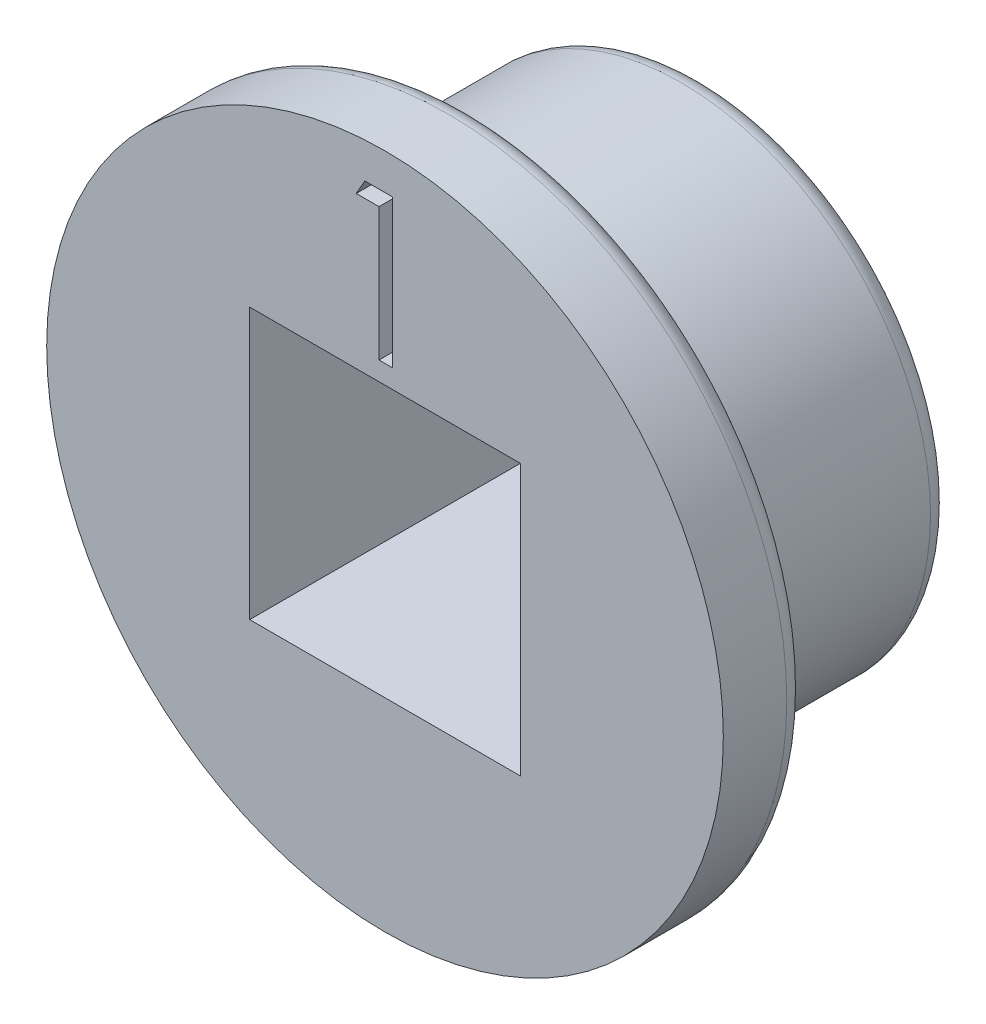
from build123d import *

# Parameters (mm, degrees)
SKETCH1_R           = 5.9
SKETCH1_W           = 6.4
SKETCH1_H           = 6.4
BOSS_EXTRUDE1_DEPTH = 5.5
SKETCH1_3_R         = 8
SKETCH1_3_W         = 6.4
SKETCH1_3_H         = 6.4
BOSS_EXTRUDE2_DEPTH = 2
FILLET1_R           = 0.5
CUT_EXTRUDE1_DEPTH  = 0.5


with BuildPart() as part:
    # Sketch1 → Boss-Extrude1 (new body)
    with BuildSketch(Plane.XY):
        Circle(SKETCH1_R)
        Rectangle(SKETCH1_W, SKETCH1_H, mode=Mode.SUBTRACT)
    extrude(amount=-BOSS_EXTRUDE1_DEPTH)

    # Sketch1<3> → Boss-Extrude2 (add)
    with BuildSketch(Plane.XY):
        Circle(SKETCH1_3_R)
        Rectangle(SKETCH1_3_W, SKETCH1_3_H, mode=Mode.SUBTRACT)
    extrude(amount=BOSS_EXTRUDE2_DEPTH)

    # Fillet1
    fillet1_edges = [part.edges().sort_by_distance(p)[0] for p in [
        (-8, 0, 0),
        (-5.9, 0, -5.5),
    ]]
    fillet(fillet1_edges, radius=FILLET1_R)

    # Sketch2 → Cut-Extrude1 (cut)
    with BuildSketch(Plane.XY.offset(2)):
        Polygon((-0.475804426, 7.144860485), (0.171330991, 7.144860485), (0.171330991, 3.644860485), (-0.142771573, 3.644860485), (-0.142771573, 6.785886126), (-0.681233112, 6.785886126), align=None)
    extrude(amount=-CUT_EXTRUDE1_DEPTH, mode=Mode.SUBTRACT)


solid = part.part
